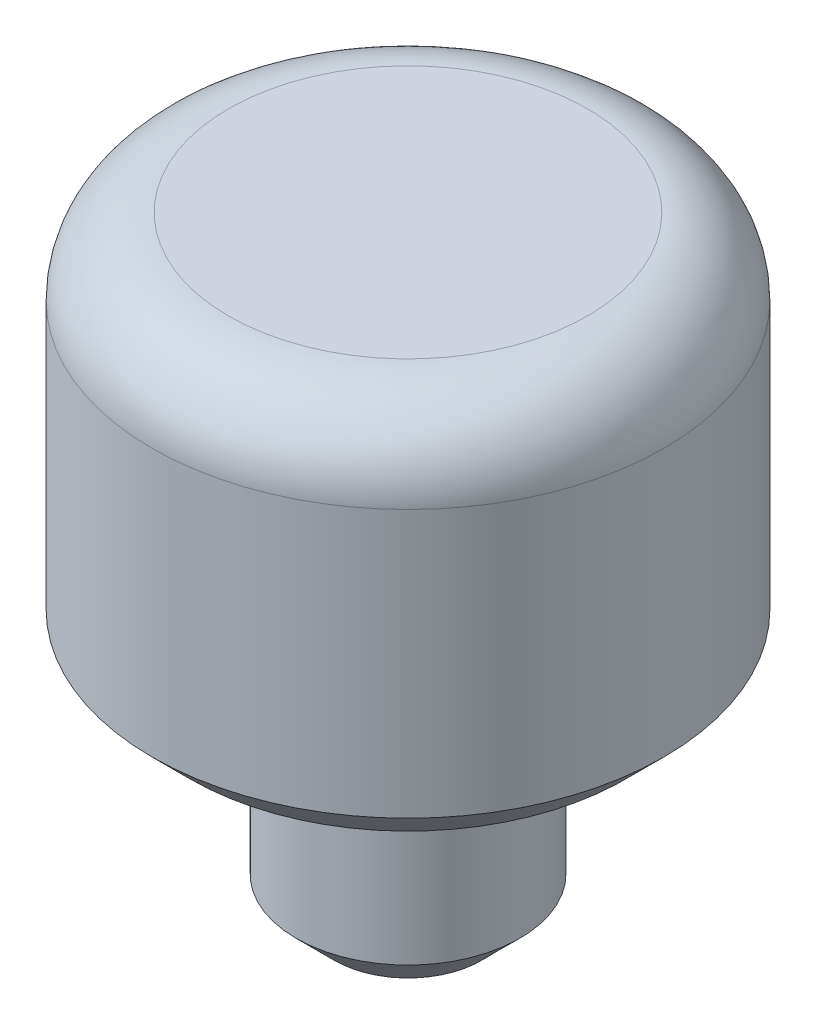
from build123d import *

# Parameters (mm, degrees)
SKETCH_1_R      = 6.7
EXTRUDE_1_DEPTH = 10
SKETCH_1_5_R    = 2.925
EXTRUDE_2_DEPTH = 6
CHAMFER_1_SIZE  = 1
FILLET_1_R      = 0.4
FILLET_2_R      = 2


with BuildPart() as part:
    # Эскиз1 → Бобышка-Вытянуть1 (new body)
    with BuildSketch(Plane(origin=(0, 0, 0), x_dir=(1, 0, 0), z_dir=(0, 1, 0))):
        Circle(SKETCH_1_R)
    extrude(amount=EXTRUDE_1_DEPTH)

    # Эскиз1<5> → Бобышка-Вытянуть2 (add)
    with BuildSketch(Plane(origin=(0, 0, 0), x_dir=(1, 0, 0), z_dir=(0, 1, 0))):
        Circle(SKETCH_1_5_R)
    extrude(amount=-EXTRUDE_2_DEPTH)

    # Фаска1
    chamfer_1_edges = [part.edges().sort_by_distance(p)[0] for p in [
        (-2.925, -6, 0),
        (-6.7, 0, 0),
    ]]
    chamfer(chamfer_1_edges, length=CHAMFER_1_SIZE)

    # Скругление1
    fillet_1_edges = [part.edges().sort_by_distance(p)[0] for p in [
        (-2.925, 0, 0),
    ]]
    fillet(fillet_1_edges, radius=FILLET_1_R)

    # Скругление2
    fillet_2_edges = [part.edges().sort_by_distance(p)[0] for p in [
        (-6.7, 10, 0),
    ]]
    fillet(fillet_2_edges, radius=FILLET_2_R)


solid = part.part
